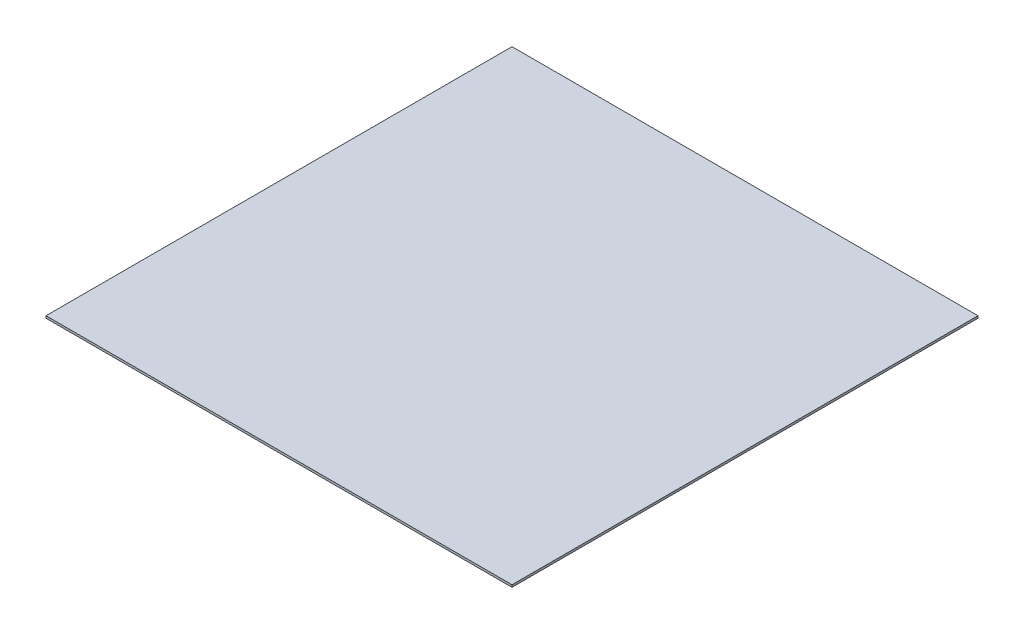
from build123d import *

# Parameters (mm, degrees)
SKETCH1_W           = 2000
SKETCH1_H           = 2000
BOSS_EXTRUDE1_DEPTH = 9.525


with BuildPart() as part:
    # Sketch1 → Boss-Extrude1 (new body)
    with BuildSketch(Plane(origin=(0, 0, 0), x_dir=(1, 0, 0), z_dir=(0, 1, 0))):
        with Locations((1000, -1000)):
            Rectangle(SKETCH1_W, SKETCH1_H)
    extrude(amount=BOSS_EXTRUDE1_DEPTH)


solid = part.part
